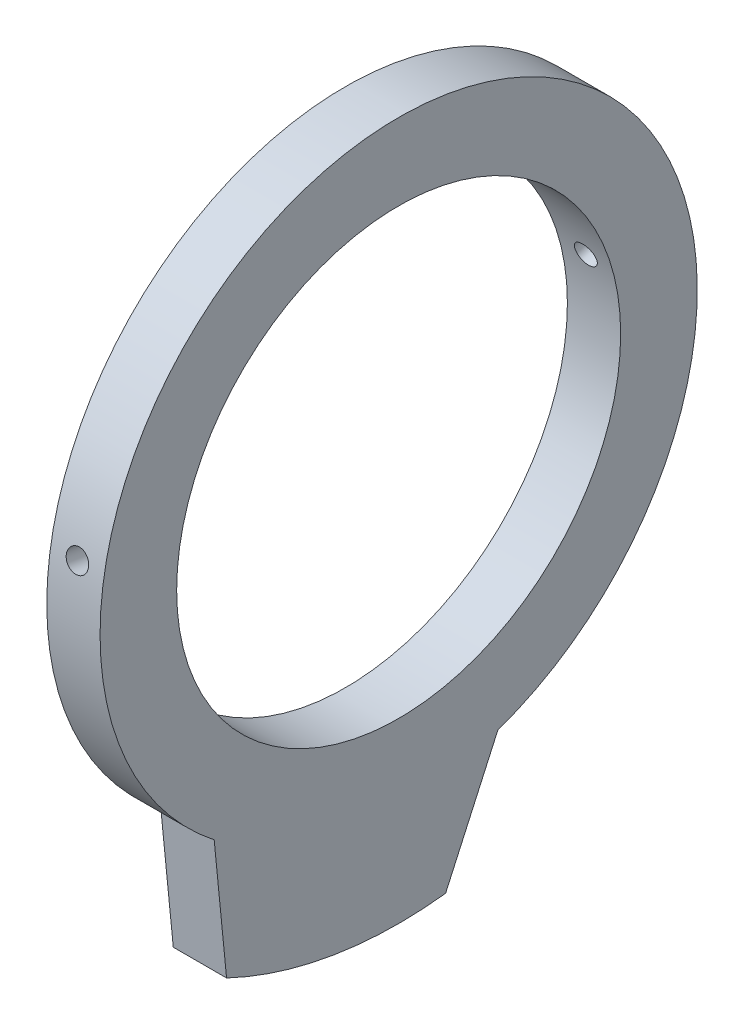
from build123d import *

# Parameters (mm, degrees)
SKETCH_1_R               = 67.25
EXTRUDE_1_DEPTH          = 12
EXTRUDE_2_DEPTH          = 12
CUT_EXTRUDE_1_DEPTH      = 113.989214087
CUT_EXTRUDE_1_DEPTH_BACK = 113.989214087
SKETCH_3_R               = 50


with BuildPart() as part:
    # ｽｹｯﾁ1 → ﾎﾞｽ - 押し出し1 (new body)
    with BuildSketch(Plane(origin=(0, 0, 0), x_dir=(0, 0, -1), z_dir=(1, 0, 0))):
        Circle(SKETCH_1_R)
    extrude(amount=EXTRUDE_1_DEPTH)

    # ｽｹｯﾁ2 → ﾎﾞｽ - 押し出し2 (add)
    with BuildSketch(Plane(origin=(0, 0, 0), x_dir=(0, 0, -1), z_dir=(1, 0, 0))):
        with BuildLine():
            Line((-41.549382629, -52.879214282), (-38.758443712, -81.226738461))
            ThreePointArc((-38.758443712, -81.226738461), (-14.671715608, -88.796062757), (10.569667713, -89.37719018))
            Line((10.569667713, -89.37719018), (22.328272087, -63.435090964))
            Line((22.328272087, -63.435090964), (-41.549382629, -52.879214282))
        make_face()
    extrude(amount=EXTRUDE_2_DEPTH)

    # ｽｹｯﾁ3 → ｶｯﾄ - 押し出し1 (cut, two sides: drawn at the far end of the back side and taken through both)
    with BuildSketch(Plane(origin=(0, 0, 0), x_dir=(0, 0, -1), z_dir=(1, 0, 0)).offset(-CUT_EXTRUDE_1_DEPTH_BACK)):
        Circle(SKETCH_3_R)
    extrude(amount=CUT_EXTRUDE_1_DEPTH + CUT_EXTRUDE_1_DEPTH_BACK, mode=Mode.SUBTRACT)

    # ｽｹｯﾁ4 → ｶｯﾄ - 回転1 (revolve, cut)
    with BuildSketch(Plane(origin=(6, 0, 0), x_dir=(0, 0, -1), z_dir=(1, 0, 0)), mode=Mode.PRIVATE) as cut_revolve_1_sk:
        Polygon((-44.399328848, 7.328000946), (-73.998881413, 12.21333491), (-74.405992577, 9.74670553), (-44.806440011, 4.861371566), align=None)
    revolve(cut_revolve_1_sk.sketch.rotate(Axis((6, 0, 0), (0, 0.1628444654719115, 0.9866517521725523)), 180), axis=Axis((6, 0, 0), (0, 0.1628444654719115, 0.9866517521725523)), mode=Mode.SUBTRACT)

    # ｽｹｯﾁ5 → ｶｯﾄ - 回転2 (revolve, cut)
    with BuildSketch(Plane(origin=(6, 0, 0), x_dir=(0, 0, -1), z_dir=(1, 0, 0)), mode=Mode.PRIVATE) as cut_revolve_2_sk:
        Polygon((43.338895176, 12.113635497), (72.231491959, 20.189392495), (71.55851221, 22.597108894), (42.665915426, 14.521351896), align=None)
    revolve(cut_revolve_2_sk.sketch.rotate(Axis((6, 0, 0), (0, 0.2691918999319745, -0.9630865594592284)), 180), axis=Axis((6, 0, 0), (0, 0.2691918999319745, -0.9630865594592284)), mode=Mode.SUBTRACT)


solid = part.part
